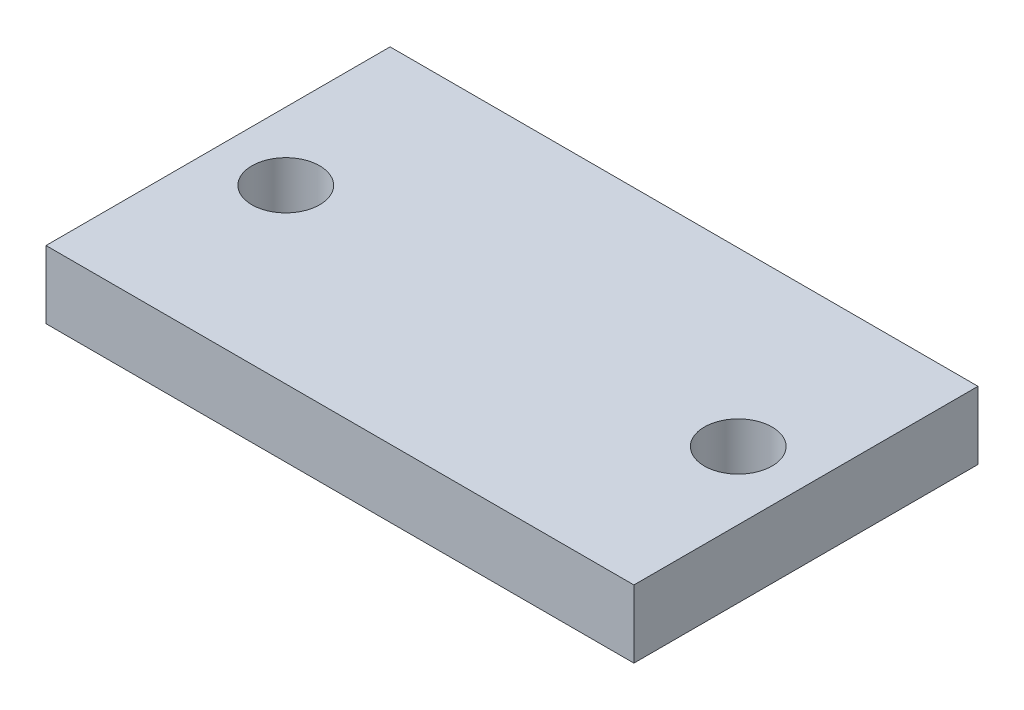
from build123d import *

# Parameters (mm, degrees)
SKETCH2_W           = 25.4
SKETCH2_H           = 25.4
BOSS_EXTRUDE6_DEPTH = 5
BOSS_EXTRUDE7_DEPTH = 5
FILLET1_R           = 5
SKETCH5_R           = 1
CUT_EXTRUDE1_DEPTH  = 5
SKETCH6_W           = 28.098270468
SKETCH6_H           = 9.80175879
CUT_EXTRUDE2_DEPTH  = 49.905214446
SKETCH7_W           = 43.4
SKETCH7_H           = 25.4
SKETCH7_R           = 2.5
BOSS_EXTRUDE8_DEPTH = 5
SKETCH8_R           = 2.5
CUT_EXTRUDE3_DEPTH  = 10


with BuildPart() as part:
    # Sketch2 → Boss-Extrude6 (new body)
    with BuildSketch(Plane(origin=(0, 0, 0), x_dir=(1, 0, 0), z_dir=(0, 1, 0))):
        with Locations((12.7, 12.7)):
            Rectangle(SKETCH2_W, SKETCH2_H)
    extrude(amount=BOSS_EXTRUDE6_DEPTH)

    # Sketch4 → Boss-Extrude7 (add)
    with BuildSketch(Plane.XZ):
        with BuildLine():
            Line((25.4, 0), (25.4, -9.7))
            ThreePointArc((25.4, -9.7), (34.4, -12.7), (25.4, -15.7))
            Line((25.4, -15.7), (25.4, -25.4))
            Line((25.4, -25.4), (15.7, -25.4))
            ThreePointArc((15.7, -25.4), (12.7, -34.4), (9.7, -25.4))
            Line((9.7, -25.4), (0, -25.4))
            Line((0, -25.4), (0, -15.7))
            ThreePointArc((0, -15.7), (-9, -12.7), (0, -9.7))
            Line((0, -9.7), (0, 0))
            Line((0, 0), (9.7, 0))
            Line((9.7, 0), (15.7, 0))
            Line((15.7, 0), (25.4, 0))
        make_face()
    extrude(amount=-BOSS_EXTRUDE7_DEPTH)

    # Fillet1
    fillet1_edges = [part.edges().sort_by_distance(p)[0] for p in [
        (25.4, 2.5, -9.7),
        (25.4, 2.5, -15.7),
        (15.7, 2.5, -25.4),
        (9.7, 2.5, -25.4),
        (0, 2.5, -15.7),
        (0, 2.5, -9.7),
    ]]
    fillet(fillet1_edges, radius=FILLET1_R)

    # Sketch5 → Cut-Extrude1 (cut)
    with BuildSketch(Plane(origin=(0, 5, 0), x_dir=(1, 0, 0), z_dir=(0, 1, 0))):
        with Locations(Location((-4, 12.7, 0), (0, 0, 270))):
            Circle(SKETCH5_R)
        with Locations(Location((12.7, 29.4, 0), (0, 0, 270))):
            Circle(SKETCH5_R)
        with Locations(Location((29.4, 12.7, 0), (0, 0, 270))):
            Circle(SKETCH5_R)
    extrude(amount=-CUT_EXTRUDE1_DEPTH, mode=Mode.SUBTRACT)

    # Sketch6 → Cut-Extrude2 (cut, through all)
    with BuildSketch(Plane(origin=(0, 5, 0), x_dir=(1, 0, 0), z_dir=(0, 1, 0))):
        with Locations((14.049135234, 30.300879395)):
            Rectangle(SKETCH6_W, SKETCH6_H)
    extrude(amount=-CUT_EXTRUDE2_DEPTH, mode=Mode.SUBTRACT)

    # Sketch7 → Boss-Extrude8 (add)
    with BuildSketch(Plane(origin=(0, 5, 0), x_dir=(1, 0, 0), z_dir=(0, 1, 0))):
        with Locations((12.7, 12.7)):
            Rectangle(SKETCH7_W, SKETCH7_H)
        with Locations((-4, 12.7)):
            Circle(SKETCH7_R, mode=Mode.SUBTRACT)
        with Locations((29.4, 12.7)):
            Circle(SKETCH7_R, mode=Mode.SUBTRACT)
    extrude(amount=-BOSS_EXTRUDE8_DEPTH)

    # Sketch8 → Cut-Extrude3 (cut)
    with BuildSketch(Plane(origin=(0, 5, 0), x_dir=(1, 0, 0), z_dir=(0, 1, 0))):
        with Locations(Location((-4, 12.7, 0), (0, 0, 270))):
            Circle(SKETCH8_R)
        with Locations(Location((29.4, 12.7, 0), (0, 0, 270))):
            Circle(SKETCH8_R)
    extrude(amount=-CUT_EXTRUDE3_DEPTH, mode=Mode.SUBTRACT)


solid = part.part
